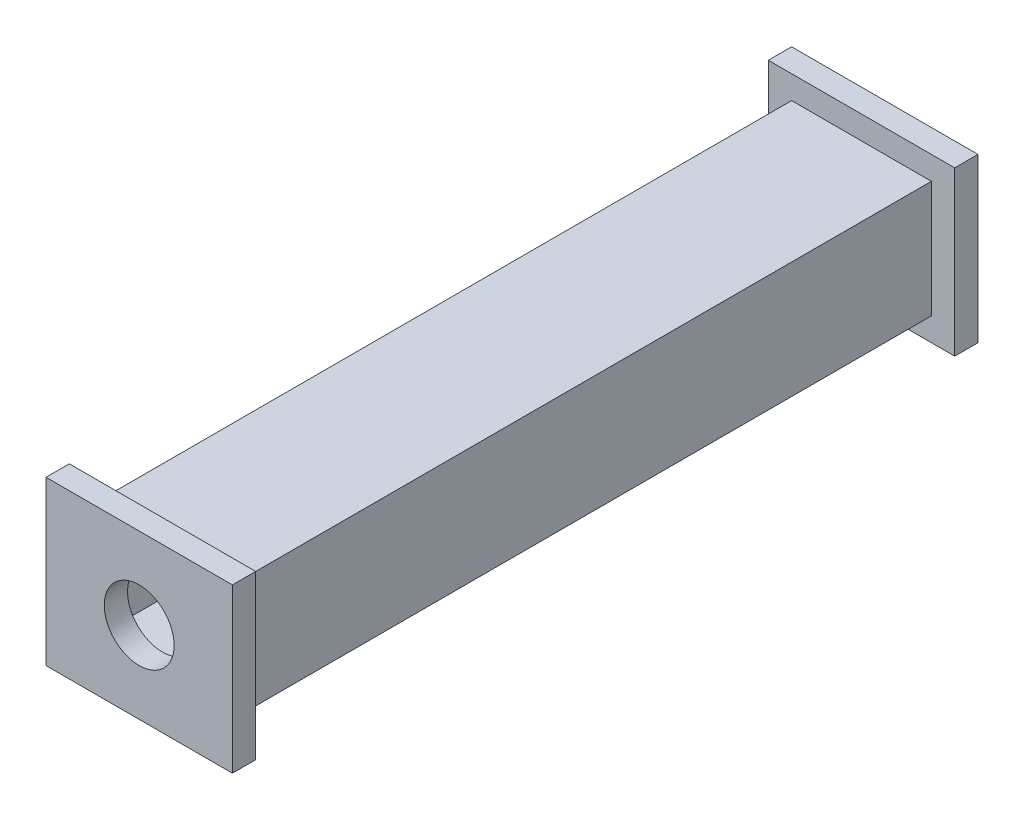
from build123d import *

# Parameters (mm, degrees)
SKETCH_8_W      = 60
SKETCH_8_H      = 50
SKETCH_8_W_2    = 50
SKETCH_8_H_2    = 40
EXTRUDE_1_DEPTH = 150
SKETCH_9_W      = 80
SKETCH_9_H      = 70
SKETCH_9_R      = 15
EXTRUDE_2_DEPTH = 10
EXTRUDE_START   = 10
SKETCH_10_W     = 80
SKETCH_10_H     = 70
SKETCH_10_R     = 15
EXTRUDE_3_DEPTH = 10


with BuildPart() as part:
    # 草图8 → 凸台-拉伸1 (new, symmetric)
    with BuildSketch(Plane.XY):
        Rectangle(SKETCH_8_W, SKETCH_8_H)
        Rectangle(SKETCH_8_W_2, SKETCH_8_H_2, mode=Mode.SUBTRACT)
    extrude(amount=EXTRUDE_1_DEPTH, both=True)

    # 草图9 → 凸台-拉伸2 (add)
    with BuildSketch(Plane.XY.offset(150)):
        Rectangle(SKETCH_9_W, SKETCH_9_H)
        Circle(SKETCH_9_R, mode=Mode.SUBTRACT)
    extrude(amount=EXTRUDE_2_DEPTH)

    # 草图10 → 凸台-拉伸3 (add)
    with BuildSketch(Plane(origin=(0, 0, -150), x_dir=(-1, 0, 0), z_dir=(0, 0, -1)).offset(EXTRUDE_START)):
        Rectangle(SKETCH_10_W, SKETCH_10_H)
        with Locations(Location((0, 0, 0), (0, 0, 180))):
            Circle(SKETCH_10_R, mode=Mode.SUBTRACT)
    extrude(amount=-EXTRUDE_3_DEPTH)


solid = part.part
